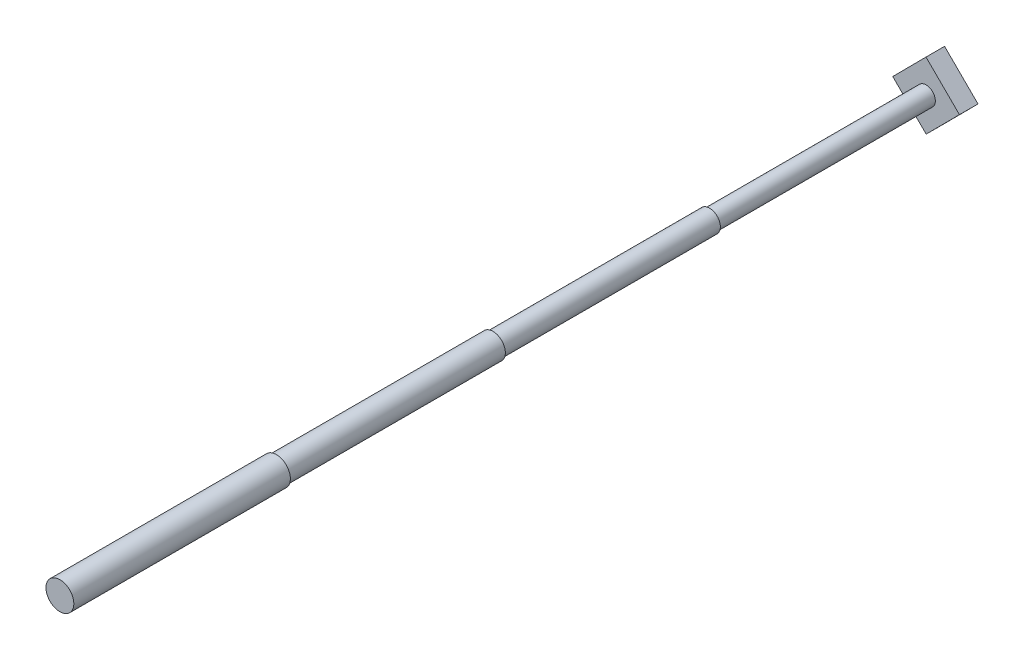
from build123d import *

# Parameters (mm, degrees)
ESQUISSE1_R        = 45
BOSS_EXTRU_1_DEPTH = 700
ESQUISSE2_R        = 40
BOSS_EXTRU_4_DEPTH = 700
ESQUISSE3_R        = 35
BOSS_EXTRU_5_DEPTH = 700
ESQUISSE4_R        = 30
BOSS_EXTRU_6_DEPTH = 700
BOSS_EXTRU_7_DEPTH = 60


with BuildPart() as part:
    # Esquisse1 → Boss.-Extru.1 (new body)
    with BuildSketch(Plane.XY):
        with Locations((-5.0559795, 0.208317709)):
            Circle(ESQUISSE1_R)
    extrude(amount=BOSS_EXTRU_1_DEPTH)

    # Esquisse2 → Boss.-Extru.4 (add)
    with BuildSketch(Plane(origin=(0, 0, 0), x_dir=(-1, 0, 0), z_dir=(0, 0, -1))):
        with Locations(Location((5.0559795, 0.208317709, 0), (0, 0, 180))):
            Circle(ESQUISSE2_R)
    extrude(amount=BOSS_EXTRU_4_DEPTH)

    # Esquisse3 → Boss.-Extru.5 (add)
    with BuildSketch(Plane(origin=(0, 0, -700), x_dir=(-1, 0, 0), z_dir=(0, 0, -1))):
        with Locations((5.0559795, 0.208317709)):
            Circle(ESQUISSE3_R)
    extrude(amount=BOSS_EXTRU_5_DEPTH)

    # Esquisse4 → Boss.-Extru.6 (add)
    with BuildSketch(Plane(origin=(0, 0, -1400), x_dir=(-1, 0, 0), z_dir=(0, 0, -1))):
        with Locations((5.0559795, 0.208317709)):
            Circle(ESQUISSE4_R)
    extrude(amount=BOSS_EXTRU_6_DEPTH)

    # Esquisse5 → Boss.-Extru.7 (add)
    with BuildSketch(Plane(origin=(0, 0, -2100), x_dir=(-1, 0, 0), z_dir=(0, 0, -1))):
        Polygon((4.785922621, -107.572959404), (112.836533333, -0.270056879), (5.305557146, 108.010216758), (-102.745053566, 0.707314234), align=None)
    extrude(amount=BOSS_EXTRU_7_DEPTH)


solid = part.part
